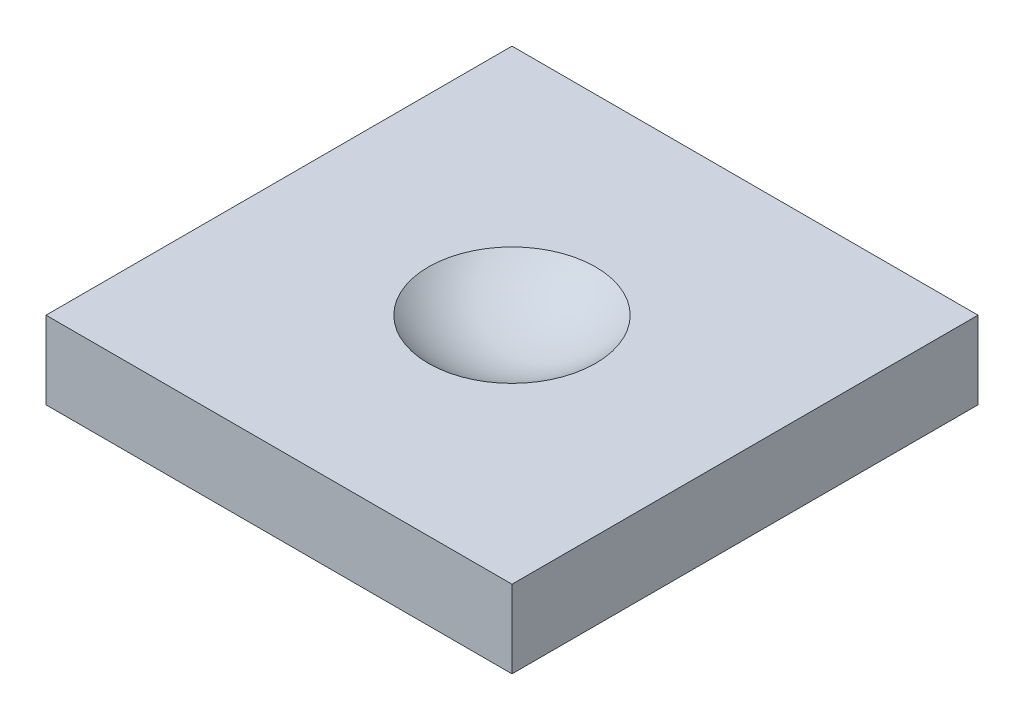
from build123d import *

# Parameters (mm, degrees)
SKETCH_2_W          = 120
SKETCH_2_H          = 120
EXTRUDE_1_DEPTH     = 20
SKETCH_4_W          = 99.85
SKETCH_4_H          = 99.9
CUT_EXTRUDE_1_DEPTH = 8


with BuildPart() as part:
    # 草图2 → 凸台-拉伸1 (new body)
    with BuildSketch(Plane(origin=(0, 0, 0), x_dir=(1, 0, 0), z_dir=(0, 1, 0))):
        Rectangle(SKETCH_2_W, SKETCH_2_H)
    extrude(amount=EXTRUDE_1_DEPTH)

    # 草图3 → 切除-旋转4 (revolve, cut)
    with BuildSketch(Plane.XY):
        with BuildLine():
            Line((-31.5, 43), (0, 43))
            Line((0, 43), (31.5, 43))
            ThreePointArc((31.5, 43), (0, 74.5), (-31.5, 43))
        make_face()
    revolve(axis=Axis((-31.5, 43, 0), (1, 0, 0)), mode=Mode.SUBTRACT)

    # 草图4 → 切除-拉伸1 (cut)
    with BuildSketch(Plane(origin=(0, 0, 0), x_dir=(1, 0, 0), z_dir=(0, 1, 0))):
        Rectangle(SKETCH_4_W, SKETCH_4_H)
    extrude(amount=CUT_EXTRUDE_1_DEPTH, mode=Mode.SUBTRACT)


solid = part.part
